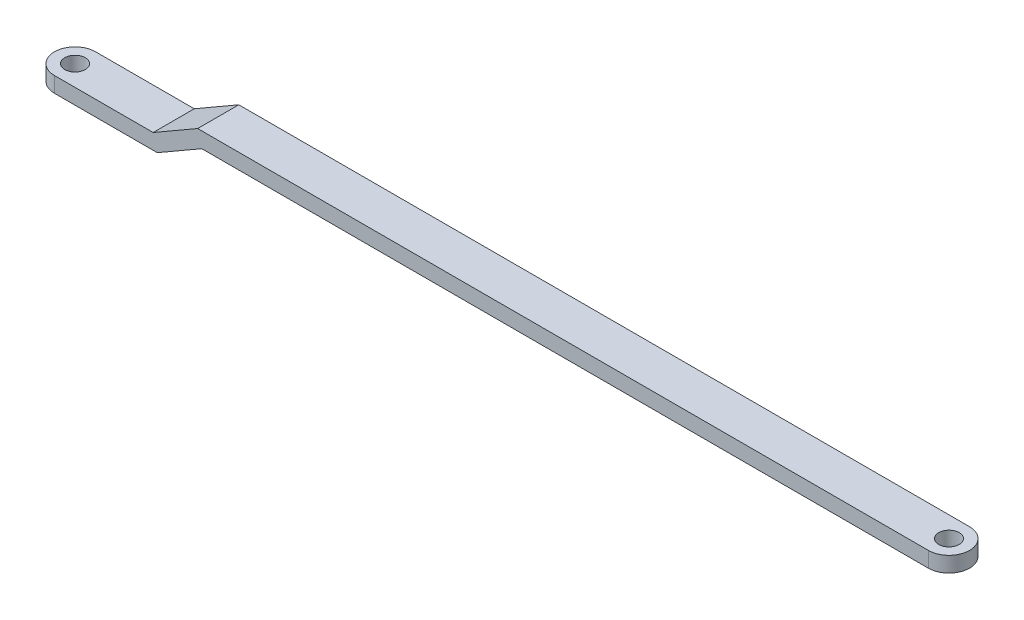
from build123d import *

# Parameters (mm, degrees)
SKETCH1_R           = 2
BOSS_EXTRUDE1_DEPTH = 8
SKETCH2_W           = 4
SKETCH2_H           = 2
SKETCH2_H_2         = 3
CUT_EXTRUDE1_DEPTH  = 8


with BuildPart() as part:
    # Sketch1 → Boss-Extrude1 (new body)
    with BuildSketch(Plane(origin=(0, 0, 0), x_dir=(1, 0, 0), z_dir=(0, 1, 0))):
        with BuildLine():
            Line((170, 4), (0, 4))
            ThreePointArc((0, 4), (-4, 0), (0, -4))
            Line((0, -4), (170, -4))
            ThreePointArc((170, -4), (174, 0), (170, 4))
        make_face()
        with Locations(Location((0, 0, 0), (0, 0, 270))):
            Circle(SKETCH1_R, mode=Mode.SUBTRACT)
        with Locations(Location((170, 0, 0), (0, 0, 270))):
            Circle(SKETCH1_R, mode=Mode.SUBTRACT)
    extrude(amount=BOSS_EXTRUDE1_DEPTH)

    # Sketch2 → Cut-Extrude1 (cut)
    with BuildSketch(Plane.XY.offset(4)):
        Polygon((22.660254038, 5), (0, 5), (0, 3), (19.196152423, 3), align=None)
        with Locations((-2, 4)):
            Rectangle(SKETCH2_W, SKETCH2_H)
        with Locations((-2, 6.5)):
            Rectangle(SKETCH2_W, SKETCH2_H_2)
        Polygon((0, 8), (0, 5), (22.660254038, 5), (27.856406461, 8), align=None)
        Polygon((170, 3), (25.196152423, 3), (20, 0), (170, 0), align=None)
        Polygon((170, 5), (28.660254038, 5), (25.196152423, 3), (170, 3), align=None)
        with Locations((172, 4)):
            Rectangle(SKETCH2_W, SKETCH2_H)
        with Locations((172, 1.5)):
            Rectangle(SKETCH2_W, SKETCH2_H_2)
    extrude(amount=-CUT_EXTRUDE1_DEPTH, mode=Mode.SUBTRACT)


solid = part.part
